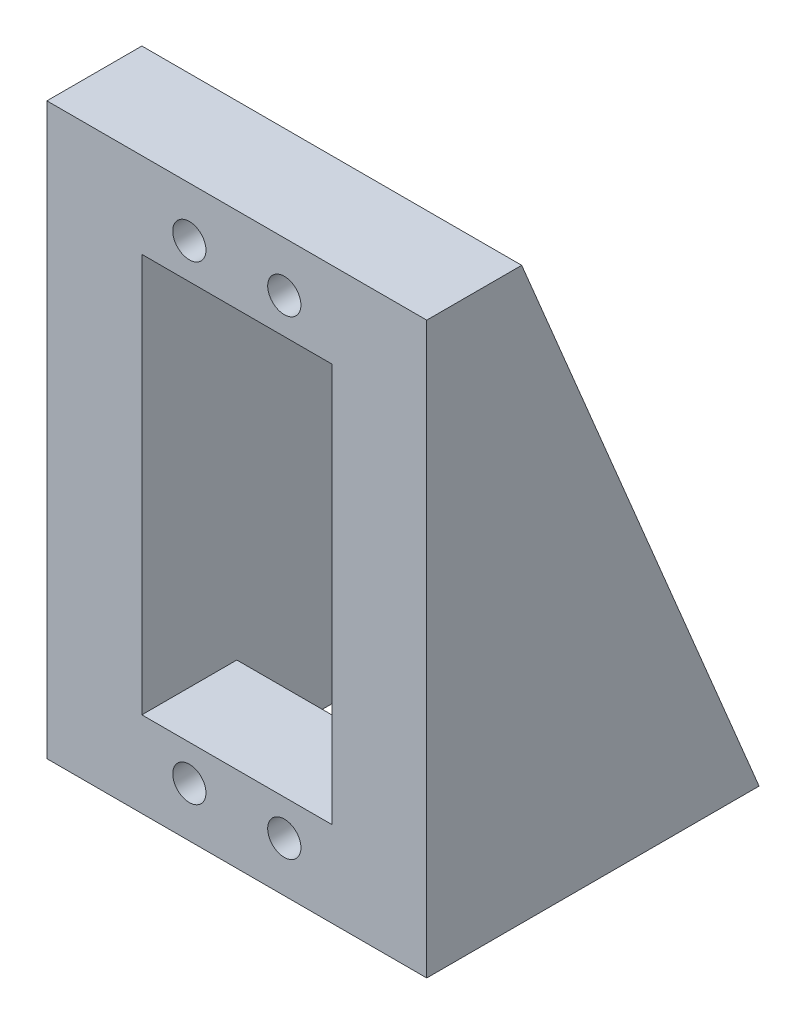
from build123d import *

# Parameters (mm, degrees)
SKETCH2_W           = 40
SKETCH2_H           = 60
SKETCH2_R           = 1.75
SKETCH2_W_2         = 22
SKETCH2_H_2         = 42
BOSS_EXTRUDE1_DEPTH = 10
BOSS_EXTRUDE3_DEPTH = 10
LPATTERN2_COUNT     = 2
LPATTERN2_PITCH     = 30
SKETCH5_R           = 1.25
CUT_EXTRUDE1_DEPTH  = 12


with BuildPart() as part:
    # Sketch2 → Boss-Extrude1 (new body)
    with BuildSketch(Plane.XY):
        Rectangle(SKETCH2_W, SKETCH2_H)
        with Locations((-5, 24.75)):
            Circle(SKETCH2_R, mode=Mode.SUBTRACT)
        with Locations((5, 24.75)):
            Circle(SKETCH2_R, mode=Mode.SUBTRACT)
        with Locations((-5, -24.75)):
            Circle(SKETCH2_R, mode=Mode.SUBTRACT)
        with Locations((5, -24.75)):
            Circle(SKETCH2_R, mode=Mode.SUBTRACT)
        Rectangle(SKETCH2_W_2, SKETCH2_H_2, mode=Mode.SUBTRACT)
    extrude(amount=BOSS_EXTRUDE1_DEPTH)

    # Sketch4 → Boss-Extrude3 (add)
    with BuildSketch(Plane(origin=(20, 0, 0), x_dir=(0, 0, -1), z_dir=(1, 0, 0))):
        Polygon((0, -30), (25, -30), (0, 30), (-10, 30), (-10, -30), align=None)
    boss_extrude3 = extrude(amount=-BOSS_EXTRUDE3_DEPTH)

    # LPattern2: Boss-Extrude3 ×2
    with Locations(*[(-i * LPATTERN2_PITCH, 0, 0) for i in range(1, LPATTERN2_COUNT)]):
        add(boss_extrude3)

    # Sketch5 → Cut-Extrude1 (cut)
    with BuildSketch(Plane.XZ.offset(30)):
        with Locations((-16, -16.7433949)):
            Circle(SKETCH5_R)
        with Locations((-16, 3.2566051)):
            Circle(SKETCH5_R)
        with Locations((-16, -6.7433949)):
            Circle(SKETCH5_R)
        with Locations(Location((16, -16.7433949, 0), (0, 0, 180))):
            Circle(SKETCH5_R)
        with Locations(Location((16, -6.7433949, 0), (0, 0, 180))):
            Circle(SKETCH5_R)
        with Locations(Location((16, 3.2566051, 0), (0, 0, 180))):
            Circle(SKETCH5_R)
    extrude(amount=-CUT_EXTRUDE1_DEPTH, mode=Mode.SUBTRACT)


solid = part.part
